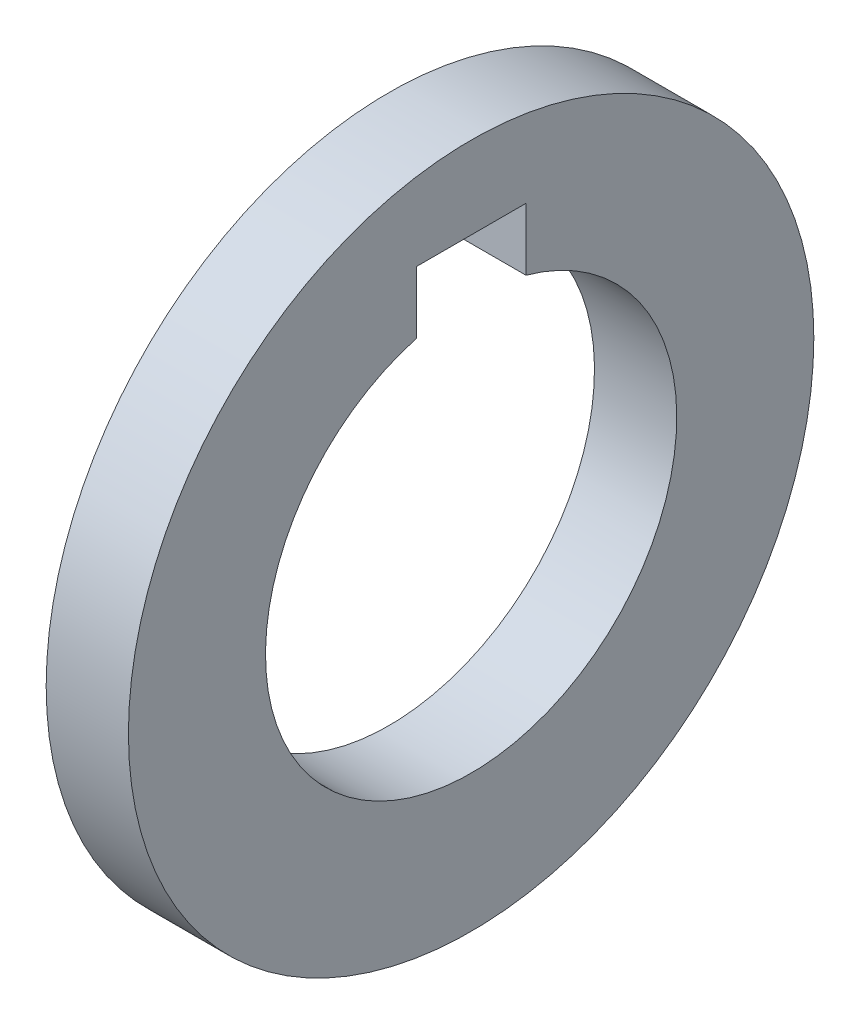
from build123d import *

# Parameters (mm, degrees)
SKETCH1_R           = 12.5
SKETCH1_R_2         = 7.5
BOSS_EXTRUDE1_DEPTH = 3
SKETCH2_W           = 4
SKETCH2_H           = 4
CUT_EXTRUDE1_DEPTH  = 10


with BuildPart() as part:
    # Sketch1 → Boss-Extrude1 (new body)
    with BuildSketch(Plane(origin=(0, 0, 0), x_dir=(0, 0, -1), z_dir=(1, 0, 0))):
        Circle(SKETCH1_R)
        Circle(SKETCH1_R_2, mode=Mode.SUBTRACT)
    extrude(amount=BOSS_EXTRUDE1_DEPTH)

    # Sketch2 → Cut-Extrude1 (cut)
    with BuildSketch(Plane.ZY):
        with Locations((0, 7.5)):
            Rectangle(SKETCH2_W, SKETCH2_H)
    extrude(amount=-CUT_EXTRUDE1_DEPTH, mode=Mode.SUBTRACT)


solid = part.part
